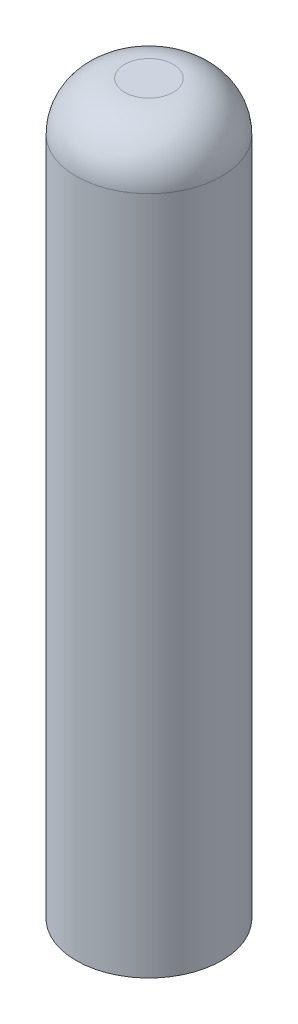
from build123d import *

# Parameters (mm, degrees)
SKETCH1_R           = 1.5
BOSS_EXTRUDE1_DEPTH = 15
FILLET1_R           = 1


with BuildPart() as part:
    # Sketch1 → Boss-Extrude1 (new body)
    with BuildSketch(Plane(origin=(0, 0, 0), x_dir=(1, 0, 0), z_dir=(0, 1, 0))):
        with Locations(Location((0, 0, 0), (0, 0, 270))):
            Circle(SKETCH1_R)
    extrude(amount=BOSS_EXTRUDE1_DEPTH)

    # Fillet1
    fillet1_edges = [part.edges().sort_by_distance(p)[0] for p in [
        (0, 15, -1.5),
    ]]
    fillet(fillet1_edges, radius=FILLET1_R)


solid = part.part
